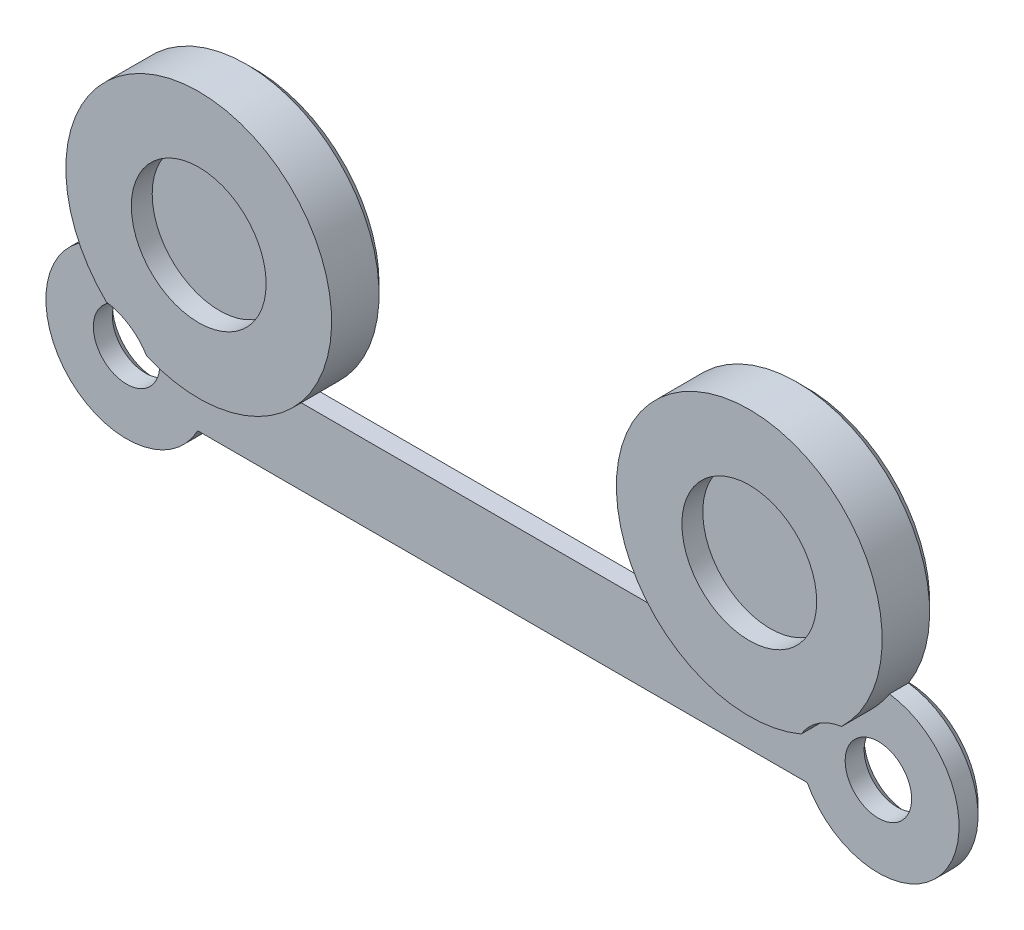
from build123d import *

# Parameters (mm, degrees)
CROQUIS1_R              = 5.05
CROQUIS1_R_2            = 1.7500000000000002
SALIENTE_EXTRUIR1_DEPTH = 1.5
CROQUIS8_R              = 7
CROQUIS8_R_2            = 3.5499999999999994
SALIENTE_EXTRUIR5_DEPTH = 1.5
CROQUIS9_R              = 3
CORTAR_EXTRUIR3_DEPTH   = 1.5
CROQUIS10_R             = 3.55
SALIENTE_EXTRUIR6_DEPTH = 0.4
CHAFL_N1_SIZE           = 0.5


with BuildPart() as part:
    # Croquis1 → Saliente-Extruir1 (new body)
    with BuildSketch(Plane.XY):
        with BuildLine():
            Line((3.75, -2.0000000000000004), (19.8, -2))
            Line((19.8, -2), (19.8, 2))
            Line((19.8, 2), (8.90555127546391, 2))
            ThreePointArc((8.905551275463925, 1.9999999999999556), (6.887272990754048, 14.817665616090519), (-0.5849400470518447, 4.209554031171866))
            ThreePointArc((-0.5849400470518499, 4.209554031171828), (-3.484830188538549, -2.4327882269220193), (3.7499999999999996, -2.0000000000000013))
        make_face()
        with Locations((5.299999999999999, 8)):
            Circle(CROQUIS1_R, mode=Mode.SUBTRACT)
        Circle(CROQUIS1_R_2, mode=Mode.SUBTRACT)
    extrude(amount=SALIENTE_EXTRUIR1_DEPTH)

    # Croquis8 → Saliente-Extruir5 (add)
    with BuildSketch(Plane.XY.offset(1.5)):
        with Locations(Location((5.299999999999999, 8, 0), (0, 0, 212.785282787))):
            Circle(CROQUIS8_R)
        with Locations((5.299999999999999, 8)):
            Circle(CROQUIS8_R_2, mode=Mode.SUBTRACT)
    extrude(amount=SALIENTE_EXTRUIR5_DEPTH)

    # Croquis9 → Cortar-Extruir3 (cut)
    with BuildSketch(Plane.XY.offset(1.5)):
        Circle(CROQUIS9_R)
    extrude(amount=CORTAR_EXTRUIR3_DEPTH, mode=Mode.SUBTRACT)

    # Croquis10 → Saliente-Extruir6 (add)
    with BuildSketch(Plane(origin=(0, 0, 1.5), x_dir=(-1, 0, 0), z_dir=(0, 0, -1))):
        with Locations((-5.299999999999999, 8)):
            Circle(CROQUIS10_R)
    extrude(amount=-SALIENTE_EXTRUIR6_DEPTH)

    # Simetría1: part across plane


with BuildPart() as part_1:
    add(part.part)
    add(part.part.mirror(Plane(origin=(19.8, 0, 1.5), x_dir=(0, 0, 1), z_dir=(1, 0, 0))))

    # Chaflán1
    chafl_n1_edges = [part_1.edges().sort_by_distance(p)[0] for p in [
        (19.8, -2.000000000000001, 0),
        (-3.484830188538548, -2.4327882269220202, 0),
        (6.887272990754054, 14.817665616090517, 0),
        (41.35, 2.1e-16, 0),
        (39.35, 8, 0),
        (32.712727009245945, 14.817665616090517, 0),
        (43.08483018853855, -2.4327882269220202, 0),
        (0.2499999999999991, 8, 0),
        (-1.7500000000000002, 2.1e-16, 0),
        (19.8, 1.999999999999977, 0),
    ]]
    chamfer(chafl_n1_edges, length=CHAFL_N1_SIZE)


solid = part_1.part
